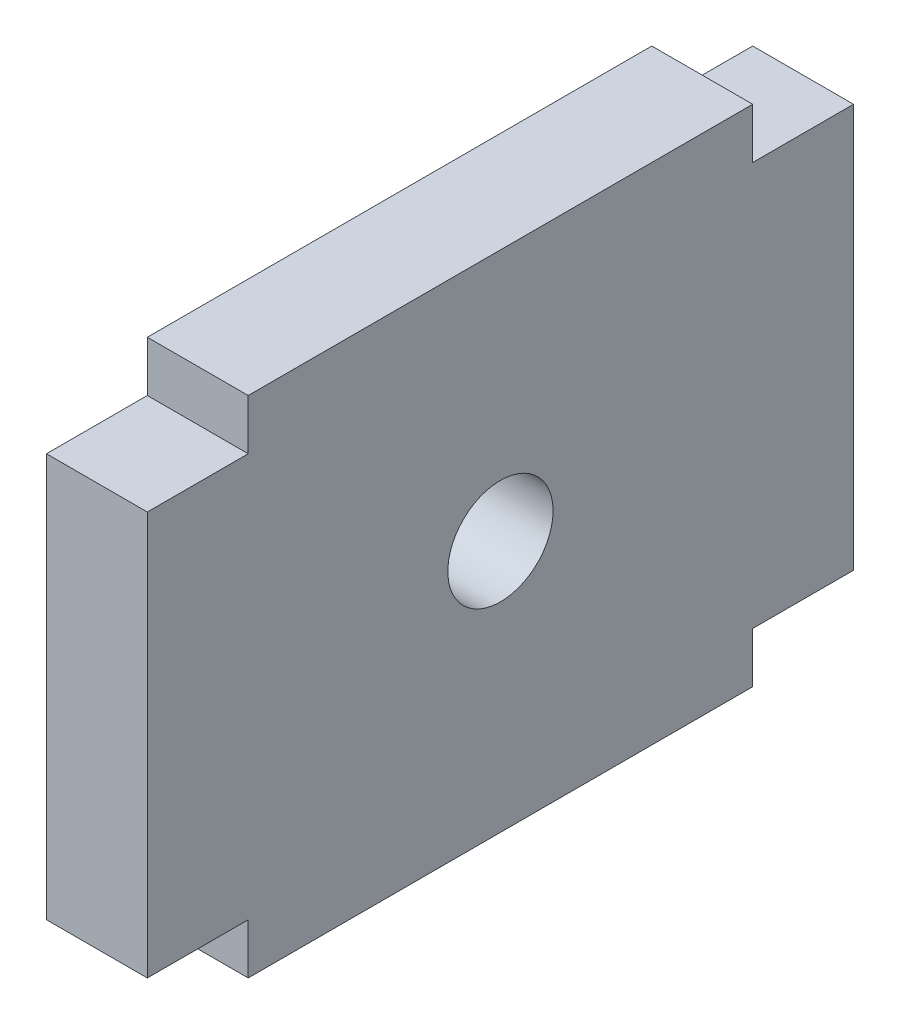
from build123d import *

# Parameters (mm, degrees)
SKICA1_W                 = 3
SKICA1_H                 = 12
SKICA1_W_2               = 15
SKICA1_H_2               = 15
P_IDAT_VYSUNUT_M1_DEPTH  = 3
SKICA2_R                 = 1.565
ODEBRAT_VYSUNUT_M1_DEPTH = 3


with BuildPart() as part:
    # Skica1 → Přidat vysunutím1 (new body)
    with BuildSketch(Plane(origin=(0, 0, 0), x_dir=(0, 0, -1), z_dir=(1, 0, 0))):
        with Locations((9, 0)):
            Rectangle(SKICA1_W, SKICA1_H)
        Rectangle(SKICA1_W_2, SKICA1_H_2)
        with Locations((-9, 0)):
            Rectangle(SKICA1_W, SKICA1_H)
    extrude(amount=P_IDAT_VYSUNUT_M1_DEPTH)

    # Skica2 → Odebrat vysunutím1 (cut)
    with BuildSketch(Plane(origin=(3, 0, 0), x_dir=(0, 0, -1), z_dir=(1, 0, 0))):
        Circle(SKICA2_R)
    extrude(amount=-ODEBRAT_VYSUNUT_M1_DEPTH, mode=Mode.SUBTRACT)


solid = part.part
